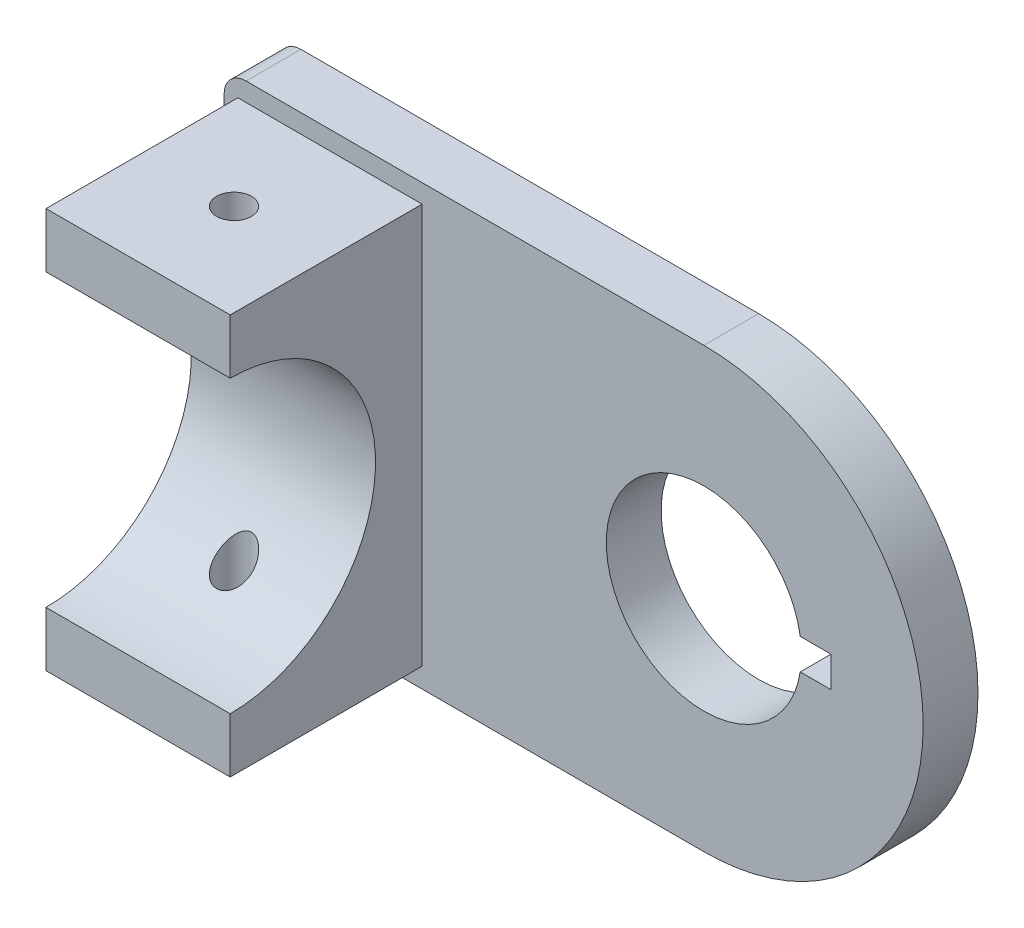
from build123d import *

# Parameters (mm, degrees)
BOSS_EXTRUDE1_DEPTH         = 6.35
SKETCH2_W                   = 21.336
SKETCH2_H                   = 46.355
BOSS_EXTRUDE2_DEPTH         = 22.225
CUT_EXTRUDE1_DEPTH          = 99.476196362
CUT_EXTRUDE1_DEPTH_BACK     = 57.531
F_10_32_TAPPED_HOLE1_REACH  = 100.678
F_10_32_TAPPED_HOLE1_BORE_R = 2.0193
F_10_32_TAPPED_HOLE2_D      = 4.0386


with BuildPart() as part:
    # Sketch1 → Boss-Extrude1 (new body)
    with BuildSketch(Plane.XY):
        with BuildLine():
            Line((2.54, 0), (55.5625, 0))
            ThreePointArc((55.5625, 0), (80.9625, 25.4), (55.5625, 50.8))
            Line((55.5625, 50.8), (2.54, 50.8))
            ThreePointArc((2.54, 50.8), (0.743948776, 50.056051224), (0, 48.26))
            Line((0, 48.26), (0, 2.54))
            ThreePointArc((0, 2.54), (0.743948776, 0.743948776), (2.54, 0))
        make_face()
        with BuildLine():
            Line((66.724781353, 27.178), (70.280781353, 27.178))
            Line((70.280781353, 27.178), (70.280781353, 23.622))
            Line((70.280781353, 23.622), (66.724781353, 23.622))
            ThreePointArc((66.724781353, 23.622), (44.2595, 25.4), (66.724781353, 27.178))
        make_face(mode=Mode.SUBTRACT)
    extrude(amount=BOSS_EXTRUDE1_DEPTH)

    # Sketch2 → Boss-Extrude2 (add)
    with BuildSketch(Plane.XY.offset(6.35)):
        with Locations((12.2555, 25.4635)):
            Rectangle(SKETCH2_W, SKETCH2_H)
    extrude(amount=BOSS_EXTRUDE2_DEPTH)

    # Sketch3 → Cut-Extrude1 (cut, two sides: drawn at the far end of the back side and taken through both)
    with BuildSketch(Plane.ZY.offset(-1.5875).offset(-CUT_EXTRUDE1_DEPTH_BACK)):
        with BuildLine():
            Line((140.654563204, 8.636), (28.575, 8.636))
            ThreePointArc((28.575, 8.636), (11.7475, 25.4635), (28.575, 42.291))
            Line((28.575, 42.291), (140.654563204, 42.291))
            Line((140.654563204, 42.291), (364.813689613, 42.291))
            Line((364.813689613, 42.291), (364.813689613, 8.636))
            Line((364.813689613, 8.636), (140.654563204, 8.636))
        make_face()
    extrude(amount=CUT_EXTRUDE1_DEPTH + CUT_EXTRUDE1_DEPTH_BACK, mode=Mode.SUBTRACT)

    # #10-32 Tapped Hole1 bore → #10-32 Tapped Hole1 (cut, up to next)
    with BuildSketch(Plane(origin=(0, 48.641, 0), x_dir=(1, 0, 0), z_dir=(0, 1, 0)), mode=Mode.PRIVATE) as f_10_32_tapped_hole1_sk1:
        with Locations((12.2555, -17.4625)):
            Circle(F_10_32_TAPPED_HOLE1_BORE_R)
    f_10_32_tapped_hole1_tool1 = extrude(f_10_32_tapped_hole1_sk1.sketch, amount=-F_10_32_TAPPED_HOLE1_REACH, mode=Mode.PRIVATE) & part.part
    add(f_10_32_tapped_hole1_tool1.solids().sort_by_distance((12.2555, 48.641, 17.4625))[0], mode=Mode.SUBTRACT)

    # #10-32 Tapped Hole2 (through all)
    with Locations(Plane(origin=(0, 2.286, 0), x_dir=(-1, 0, 0), z_dir=(0, -1, 0))):
        with Locations((-12.2555, -17.4625)):
            Hole(F_10_32_TAPPED_HOLE2_D / 2)


solid = part.part
